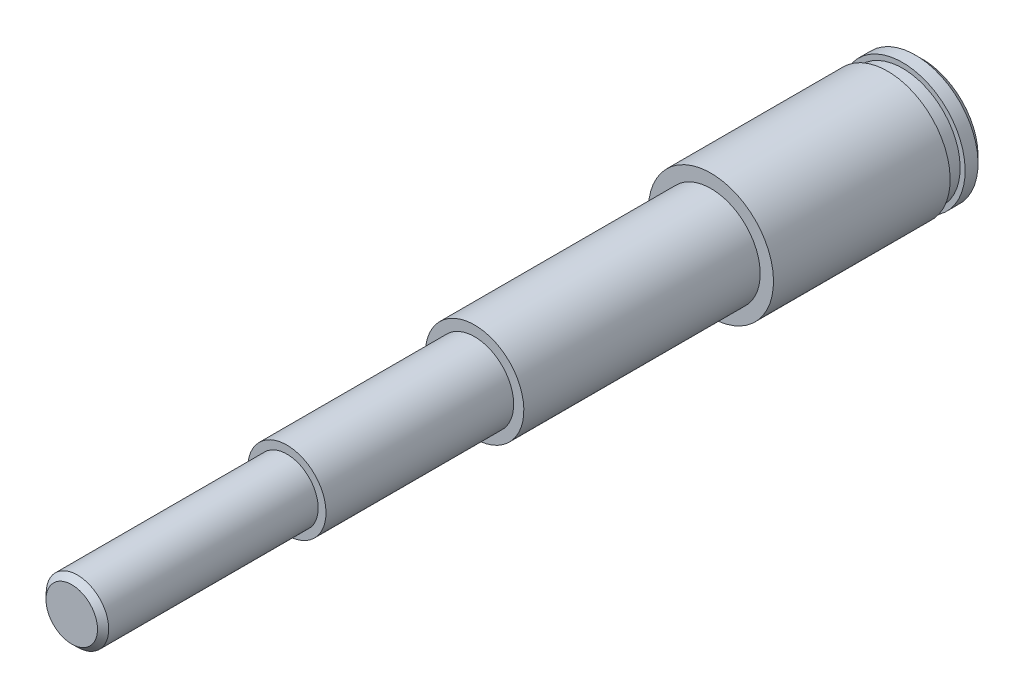
from build123d import *


with BuildPart() as part:
    # Sketch1 → Revolve1 (revolve)
    with BuildSketch(Plane(origin=(0, 0, 0), x_dir=(0, 0, -1), z_dir=(1, 0, 0)), mode=Mode.PRIVATE) as revolve1_sk:
        Polygon((-19.806770413, 0.363804758), (-19.806770413, 1.671798586), (-19.517100622, 1.951304758), (-8.883324856, 1.951304758), (-8.883324856, 2.348179758), (0.645515012, 2.348179758), (0.645515012, 2.863804758), (12.645565406, 2.863804758), (12.645565406, 3.538804758), (21.614999916, 3.538804758), (21.614999916, 3.284804758), (22.376999916, 3.284804758), (22.376999916, 3.538804758), (23.03028306, 3.538804758), (23.379331404, 3.189756414), (23.379331404, 0.363804758), align=None)
    revolve(revolve1_sk.sketch.rotate(Axis((0, 0.363804758, 19.806770413), (0, 0, -1)), 180), axis=Axis((0, 0.363804758, 19.806770413), (0, 0, -1)))


solid = part.part
